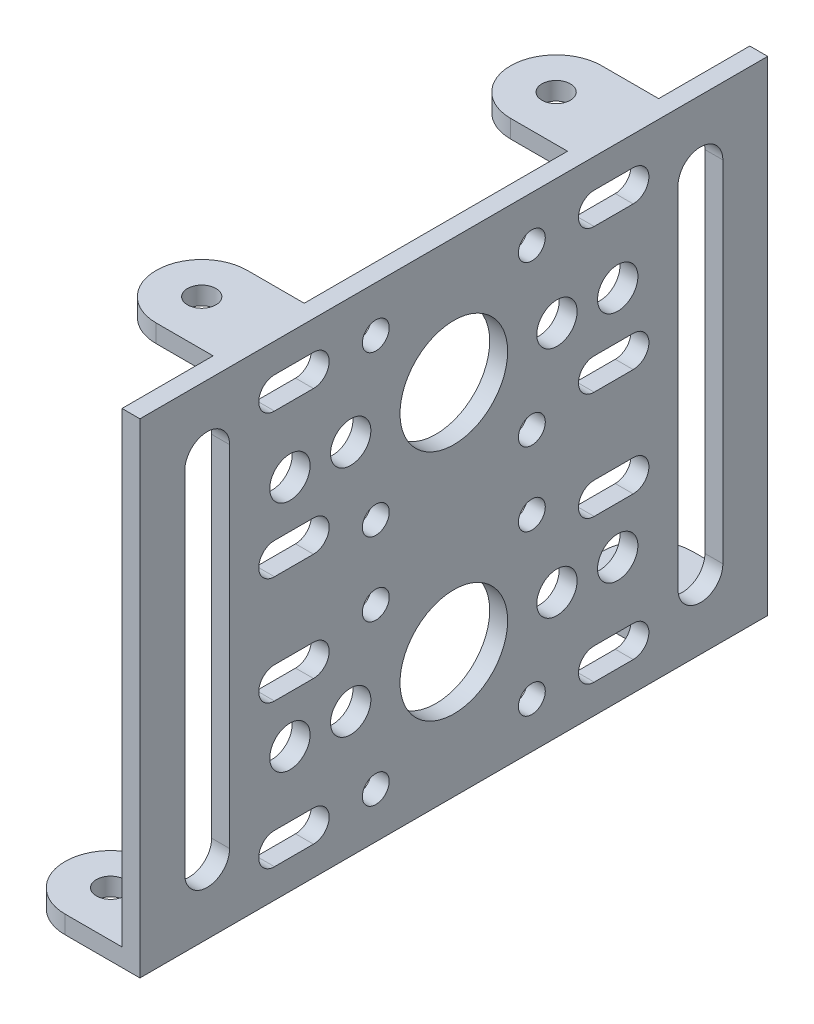
from build123d import *
from build123d.topology import SkipClean

# Parameters (mm, degrees)
SKETCH1_R            = 1.5
SKETCH1_R_2          = 2.25
BOSS_EXTRUDE1_DEPTH  = 2
BOSS_EXTRUDE3_DEPTH  = 2
SKETCH3_W            = 7.521273404
SKETCH3_H            = 51.057198878
CUT_EXTRUDE1_DEPTH   = 10
SKETCH4_R            = 1.5875
BOSS_EXTRUDE4_DEPTH  = 2
CUT_EXTRUDE2_START   = -2
SKETCH5_R            = 1.55
SKETCH5_R_2          = 1.5
CUT_EXTRUDE2_DEPTH   = 2
SKETCH7_R            = 1.5875
BOSS_EXTRUDE6_DEPTH  = 2
SKETCH8_W            = 8.556305001
SKETCH8_H            = 51.856152178
CUT_EXTRUDE3_DEPTH   = 2
SKETCH9_R            = 1.5875
BOSS_EXTRUDE31_DEPTH = 2
SKETCH10_R           = 1.5
SKETCH10_R_2         = 2.25
CUT_EXTRUDE4_DEPTH   = 10
BOSS_EXTRUDE32_START = -2
SKETCH11_R           = 2.25
BOSS_EXTRUDE32_DEPTH = 2
SKETCH12_R           = 2.25
CUT_EXTRUDE5_DEPTH   = 2
CUT_EXTRUDE6_START   = -2
SKETCH13_R           = 1.55
CUT_EXTRUDE6_DEPTH   = 2
BOSS_EXTRUDE33_START = -2
BOSS_EXTRUDE33_DEPTH = 2
CUT_EXTRUDE8_START   = -2
CUT_EXTRUDE8_DEPTH   = 2


with BuildPart() as part:
    # Sketch1 → Boss-Extrude1 (new body)
    # profile 1 of 5: a face of its own
    with BuildSketch(Plane(origin=(0, 0, 0), x_dir=(0, 0, -1), z_dir=(1, 0, 0))):
        with BuildLine():
            Line((63.077461316, 25.542000411), (88.077461316, 25.542000411))
            Line((88.077461316, 25.542000411), (88.077461316, 32.542000411))
            ThreePointArc((88.077461316, 32.542000411), (82.077461316, 38.542000411), (88.077461316, 44.542000411))
            Line((88.077461316, 44.542000411), (88.077461316, 52.542000411))
            Line((88.077461316, 52.542000411), (60.577461316, 52.542000411))
            Line((60.577461316, 52.542000411), (60.577461316, 47.542000411))
            ThreePointArc((60.577461316, 47.542000411), (62.345228269, 46.809767364), (63.077461316, 45.042000411))
            Line((63.077461316, 45.042000411), (63.077461316, 25.542000411))
        make_face()
        with Locations((72.077461316, 31.542000411)):
            Circle(SKETCH1_R, mode=Mode.SUBTRACT)
        with Locations((69.802461316, 37.748250471)):
            Circle(SKETCH1_R_2, mode=Mode.SUBTRACT)
    # profile 2 of 5: a face of its own
    with BuildSketch(Plane(origin=(0, 0, 0), x_dir=(0, 0, -1), z_dir=(1, 0, 0))):
        with BuildLine():
            Line((53.077461316, -1.457999589), (88.077461316, -1.457999589))
            Line((88.077461316, -1.457999589), (88.077461316, 6.542000411))
            ThreePointArc((88.077461316, 6.542000411), (82.077461316, 12.542000411), (88.077461316, 18.542000411))
            Line((88.077461316, 18.542000411), (88.077461316, 25.542000411))
            Line((88.077461316, 25.542000411), (63.077461316, 25.542000411))
            Line((63.077461316, 25.542000411), (63.077461316, 6.042000411))
            ThreePointArc((63.077461316, 6.042000411), (60.577461316, 3.542000411), (58.077461316, 6.042000411))
            Line((58.077461316, 6.042000411), (58.077461316, 25.542000411))
            Line((58.077461316, 25.542000411), (53.077461316, 25.542000411))
            Line((53.077461316, 25.542000411), (53.077461316, -1.457999589))
        make_face()
        with Locations((69.802461316, 13.335750351)):
            Circle(SKETCH1_R_2, mode=Mode.SUBTRACT)
        with Locations((72.077461316, 19.542000411)):
            Circle(SKETCH1_R, mode=Mode.SUBTRACT)
    # profile 3 of 5: a face of its own
    with BuildSketch(Plane(origin=(0, 0, 0), x_dir=(0, 0, -1), z_dir=(1, 0, 0))):
        with BuildLine():
            Line((53.077461316, 52.542000411), (53.077461316, 25.542000411))
            Line((53.077461316, 25.542000411), (58.077461316, 25.542000411))
            Line((58.077461316, 25.542000411), (58.077461316, 45.042000411))
            ThreePointArc((58.077461316, 45.042000411), (58.809694363, 46.809767364), (60.577461316, 47.542000411))
            Line((60.577461316, 47.542000411), (60.577461316, 52.542000411))
            Line((60.577461316, 52.542000411), (53.077461316, 52.542000411))
        make_face()
    # profile 4 of 5: a face of its own
    with BuildSketch(Plane(origin=(0, 0, 0), x_dir=(0, 0, -1), z_dir=(1, 0, 0))):
        with BuildLine():
            Line((88.077461316, 6.542000411), (88.077461316, -1.457999589))
            Line((88.077461316, -1.457999589), (123.077461316, -1.457999589))
            Line((123.077461316, -1.457999589), (123.077461316, 25.542000411))
            Line((123.077461316, 25.542000411), (118.077461316, 25.542000411))
            Line((118.077461316, 25.542000411), (118.077461316, 6.042000411))
            ThreePointArc((118.077461316, 6.042000411), (115.577461316, 3.542000411), (113.077461316, 6.042000411))
            Line((113.077461316, 6.042000411), (113.077461316, 25.542000411))
            Line((113.077461316, 25.542000411), (88.077461316, 25.542000411))
            Line((88.077461316, 25.542000411), (88.077461316, 18.542000411))
            ThreePointArc((88.077461316, 18.542000411), (92.320102003, 16.784641098), (94.077461316, 12.542000411))
            ThreePointArc((94.077461316, 12.542000411), (92.320102003, 8.299359724), (88.077461316, 6.542000411))
        make_face()
        with Locations((106.352461316, 13.335750351)):
            Circle(SKETCH1_R_2, mode=Mode.SUBTRACT)
        with Locations((104.077461316, 19.542000411)):
            Circle(SKETCH1_R, mode=Mode.SUBTRACT)
    # profile 5 of 5: a face of its own
    with BuildSketch(Plane(origin=(0, 0, 0), x_dir=(0, 0, -1), z_dir=(1, 0, 0))):
        with BuildLine():
            Line((118.077461316, 25.542000411), (123.077461316, 25.542000411))
            Line((123.077461316, 25.542000411), (123.077461316, 52.542000411))
            Line((123.077461316, 52.542000411), (88.077461316, 52.542000411))
            Line((88.077461316, 52.542000411), (88.077461316, 44.542000411))
            ThreePointArc((88.077461316, 44.542000411), (92.320102003, 42.784641098), (94.077461316, 38.542000411))
            ThreePointArc((94.077461316, 38.542000411), (92.320102003, 34.299359724), (88.077461316, 32.542000411))
            Line((88.077461316, 32.542000411), (88.077461316, 25.542000411))
            Line((88.077461316, 25.542000411), (113.077461316, 25.542000411))
            Line((113.077461316, 25.542000411), (113.077461316, 45.042000411))
            ThreePointArc((113.077461316, 45.042000411), (115.577461316, 47.542000411), (118.077461316, 45.042000411))
            Line((118.077461316, 45.042000411), (118.077461316, 25.542000411))
        make_face()
        with Locations((104.077461316, 31.542000411)):
            Circle(SKETCH1_R, mode=Mode.SUBTRACT)
        with Locations((106.352461316, 37.748250471)):
            Circle(SKETCH1_R_2, mode=Mode.SUBTRACT)
    extrude(amount=BOSS_EXTRUDE1_DEPTH)

    # Sketch2 → Boss-Extrude3 (add)
    with BuildSketch(Plane.XZ.offset(1.457999589)):
        with BuildLine():
            Line((-2.5, -123.077461316), (0, -123.077461316))
            Line((0, -123.077461316), (0, -120.577461316))
            Line((0, -120.577461316), (-0.9125, -120.577461316))
            ThreePointArc((-0.9125, -120.577461316), (-1.377467985, -121.699993331), (-2.5, -122.164961316))
            Line((-2.5, -122.164961316), (-2.5, -123.077461316))
        make_face()
        with BuildLine():
            ThreePointArc((-5, -120.577461316), (-4.267766953, -122.345228269), (-2.5, -123.077461316))
            Line((-2.5, -123.077461316), (-2.5, -122.164961316))
            ThreePointArc((-2.5, -122.164961316), (-3.622532015, -121.699993331), (-4.0875, -120.577461316))
            Line((-4.0875, -120.577461316), (-5, -120.577461316))
        make_face()
        with BuildLine():
            ThreePointArc((-2.5, -118.077461316), (-4.267766953, -118.809694363), (-5, -120.577461316))
            Line((-5, -120.577461316), (-4.0875, -120.577461316))
            ThreePointArc((-4.0875, -120.577461316), (-3.622532015, -119.454929301), (-2.5, -118.989961316))
            Line((-2.5, -118.989961316), (-2.5, -118.077461316))
        make_face()
        with BuildLine():
            Line((-0.9125, -120.577461316), (0, -120.577461316))
            Line((0, -120.577461316), (0, -118.077461316))
            Line((0, -118.077461316), (-2.5, -118.077461316))
            Line((-2.5, -118.077461316), (-2.5, -118.989961316))
            ThreePointArc((-2.5, -118.989961316), (-1.377467985, -119.454929301), (-0.9125, -120.577461316))
        make_face()
        with BuildLine():
            Line((0, -113.077461316), (0, -110.577461316))
            Line((0, -110.577461316), (-0.9125, -110.577461316))
            ThreePointArc((-0.9125, -110.577461316), (-1.377467985, -111.699993331), (-2.5, -112.164961316))
            Line((-2.5, -112.164961316), (-2.5, -113.077461316))
            Line((-2.5, -113.077461316), (0, -113.077461316))
        make_face()
        with BuildLine():
            Line((-2.5, -108.989961316), (-2.5, -108.077461316))
            ThreePointArc((-2.5, -108.077461316), (-4.267766953, -108.809694363), (-5, -110.577461316))
            Line((-5, -110.577461316), (-4.0875, -110.577461316))
            ThreePointArc((-4.0875, -110.577461316), (-3.622532015, -109.454929301), (-2.5, -108.989961316))
        make_face()
        with BuildLine():
            Line((-4.0875, -110.577461316), (-5, -110.577461316))
            ThreePointArc((-5, -110.577461316), (-4.267766953, -112.345228269), (-2.5, -113.077461316))
            Line((-2.5, -113.077461316), (-2.5, -112.164961316))
            ThreePointArc((-2.5, -112.164961316), (-3.622532015, -111.699993331), (-4.0875, -110.577461316))
        make_face()
        with BuildLine():
            Line((0, -110.577461316), (0, -108.077461316))
            Line((0, -108.077461316), (-2.5, -108.077461316))
            Line((-2.5, -108.077461316), (-2.5, -108.989961316))
            ThreePointArc((-2.5, -108.989961316), (-1.377467985, -109.454929301), (-0.9125, -110.577461316))
            Line((-0.9125, -110.577461316), (0, -110.577461316))
        make_face()
        with BuildLine():
            Line((-2.5, -68.077461316), (0, -68.077461316))
            Line((0, -68.077461316), (0, -65.577461316))
            Line((0, -65.577461316), (-0.9125, -65.577461316))
            ThreePointArc((-0.9125, -65.577461316), (-1.377467985, -66.699993331), (-2.5, -67.164961316))
            Line((-2.5, -67.164961316), (-2.5, -68.077461316))
        make_face()
        with BuildLine():
            Line((-0.9125, -65.577461316), (0, -65.577461316))
            Line((0, -65.577461316), (0, -63.077461316))
            Line((0, -63.077461316), (-2.5, -63.077461316))
            Line((-2.5, -63.077461316), (-2.5, -63.989961316))
            ThreePointArc((-2.5, -63.989961316), (-1.377467985, -64.454929301), (-0.9125, -65.577461316))
        make_face()
        with BuildLine():
            ThreePointArc((-5, -65.577461316), (-4.267766953, -67.345228269), (-2.5, -68.077461316))
            Line((-2.5, -68.077461316), (-2.5, -67.164961316))
            ThreePointArc((-2.5, -67.164961316), (-3.622532015, -66.699993331), (-4.0875, -65.577461316))
            Line((-4.0875, -65.577461316), (-5, -65.577461316))
        make_face()
        with BuildLine():
            ThreePointArc((-2.5, -63.077461316), (-4.267766953, -63.809694363), (-5, -65.577461316))
            Line((-5, -65.577461316), (-4.0875, -65.577461316))
            ThreePointArc((-4.0875, -65.577461316), (-3.622532015, -64.454929301), (-2.5, -63.989961316))
            Line((-2.5, -63.989961316), (-2.5, -63.077461316))
        make_face()
        with BuildLine():
            Line((-2.5, -53.989961316), (-2.5, -53.077461316))
            ThreePointArc((-2.5, -53.077461316), (-4.267766953, -53.809694363), (-5, -55.577461316))
            Line((-5, -55.577461316), (-4.0875, -55.577461316))
            ThreePointArc((-4.0875, -55.577461316), (-3.622532015, -54.454929301), (-2.5, -53.989961316))
        make_face()
        with BuildLine():
            Line((-4.0875, -55.577461316), (-5, -55.577461316))
            ThreePointArc((-5, -55.577461316), (-4.267766953, -57.345228269), (-2.5, -58.077461316))
            Line((-2.5, -58.077461316), (-2.5, -57.164961316))
            ThreePointArc((-2.5, -57.164961316), (-3.622532015, -56.699993331), (-4.0875, -55.577461316))
        make_face()
        with BuildLine():
            Line((0, -58.077461316), (0, -55.577461316))
            Line((0, -55.577461316), (-0.9125, -55.577461316))
            ThreePointArc((-0.9125, -55.577461316), (-1.377467985, -56.699993331), (-2.5, -57.164961316))
            Line((-2.5, -57.164961316), (-2.5, -58.077461316))
            Line((-2.5, -58.077461316), (0, -58.077461316))
        make_face()
        with BuildLine():
            Line((0, -55.577461316), (0, -53.077461316))
            Line((0, -53.077461316), (-2.5, -53.077461316))
            Line((-2.5, -53.077461316), (-2.5, -53.989961316))
            ThreePointArc((-2.5, -53.989961316), (-1.377467985, -54.454929301), (-0.9125, -55.577461316))
            Line((-0.9125, -55.577461316), (0, -55.577461316))
        make_face()
    extrude(amount=-BOSS_EXTRUDE3_DEPTH)

    # Sketch3 → Cut-Extrude1 (cut)
    with BuildSketch(Plane(origin=(0, 0.542000411, 0), x_dir=(1, 0, 0), z_dir=(0, 1, 0))):
        with Locations((-3.760636702, 87.548861877)):
            Rectangle(SKETCH3_W, SKETCH3_H)
    extrude(amount=-CUT_EXTRUDE1_DEPTH, mode=Mode.SUBTRACT)

    # Sketch4 → Boss-Extrude4 (add)
    # profile 1 of 2: a face of its own
    with BuildSketch(Plane(origin=(0, 52.542000411, 0), x_dir=(1, 0, 0), z_dir=(0, 1, 0))):
        with BuildLine():
            Line((-2.5, 108.077461316), (0, 108.077461316))
            Line((0, 108.077461316), (0, 113.077461316))
            Line((0, 113.077461316), (-2.5, 113.077461316))
            ThreePointArc((-2.5, 113.077461316), (-5, 110.577461316), (-2.5, 108.077461316))
        make_face()
        with Locations(Location((-2.5, 110.577461316, 0), (0, 0, 270))):
            Circle(SKETCH4_R, mode=Mode.SUBTRACT)
    # profile 2 of 2: a face of its own
    with BuildSketch(Plane(origin=(0, 52.542000411, 0), x_dir=(1, 0, 0), z_dir=(0, 1, 0))):
        with BuildLine():
            Line((0, 63.077461316), (0, 68.077461316))
            Line((0, 68.077461316), (-2.5, 68.077461316))
            ThreePointArc((-2.5, 68.077461316), (-5, 65.577461316), (-2.5, 63.077461316))
            Line((-2.5, 63.077461316), (0, 63.077461316))
        make_face()
        with Locations(Location((-2.5, 65.577461316, 0), (0, 0, 270))):
            Circle(SKETCH4_R, mode=Mode.SUBTRACT)
    extrude(amount=-BOSS_EXTRUDE4_DEPTH)

    # Sketch5 → Cut-Extrude2 (cut)
    # profile 1 of 12: a face of its own
    with BuildSketch(Plane(origin=(2, 0, 0), x_dir=(0, 0, -1), z_dir=(1, 0, 0)).offset(CUT_EXTRUDE2_START)):
        with Locations((108.427461316, 19.542000411)):
            Circle(SKETCH5_R)
    # profile 2 of 12: a face of its own
    with BuildSketch(Plane(origin=(2, 0, 0), x_dir=(0, 0, -1), z_dir=(1, 0, 0)).offset(CUT_EXTRUDE2_START)):
        with Locations((67.727461316, 19.542000411)):
            Circle(SKETCH5_R)
    # profile 3 of 12: a face of its own
    with BuildSketch(Plane(origin=(2, 0, 0), x_dir=(0, 0, -1), z_dir=(1, 0, 0)).offset(CUT_EXTRUDE2_START)):
        with Locations((72.077461316, 19.542000411)):
            Circle(SKETCH5_R)
        with Locations((72.077461316, 19.542000411)):
            Circle(SKETCH5_R_2, mode=Mode.SUBTRACT)
    # profile 4 of 12: a face of its own
    with BuildSketch(Plane(origin=(2, 0, 0), x_dir=(0, 0, -1), z_dir=(1, 0, 0)).offset(CUT_EXTRUDE2_START)):
        with Locations((67.727461316, 31.542000411)):
            Circle(SKETCH5_R)
    # profile 5 of 12: a face of its own
    with BuildSketch(Plane(origin=(2, 0, 0), x_dir=(0, 0, -1), z_dir=(1, 0, 0)).offset(CUT_EXTRUDE2_START)):
        with Locations((72.077461316, 31.542000411)):
            Circle(SKETCH5_R)
        with Locations((72.077461316, 31.542000411)):
            Circle(SKETCH5_R_2, mode=Mode.SUBTRACT)
    # profile 6 of 12: a face of its own
    with BuildSketch(Plane(origin=(2, 0, 0), x_dir=(0, 0, -1), z_dir=(1, 0, 0)).offset(CUT_EXTRUDE2_START)):
        with Locations((108.427461316, 31.542000411)):
            Circle(SKETCH5_R)
    # profile 7 of 12: a face of its own
    with BuildSketch(Plane(origin=(2, 0, 0), x_dir=(0, 0, -1), z_dir=(1, 0, 0)).offset(CUT_EXTRUDE2_START)):
        with Locations((67.727461316, 5.822000411)):
            Circle(SKETCH5_R)
    # profile 8 of 12: a face of its own
    with BuildSketch(Plane(origin=(2, 0, 0), x_dir=(0, 0, -1), z_dir=(1, 0, 0)).offset(CUT_EXTRUDE2_START)):
        with Locations((108.427461316, 5.822000411)):
            Circle(SKETCH5_R)
    # profile 9 of 12: a face of its own
    with BuildSketch(Plane(origin=(2, 0, 0), x_dir=(0, 0, -1), z_dir=(1, 0, 0)).offset(CUT_EXTRUDE2_START)):
        with Locations((104.077461316, 19.542000411)):
            Circle(SKETCH5_R)
        with Locations((104.077461316, 19.542000411)):
            Circle(SKETCH5_R_2, mode=Mode.SUBTRACT)
    # profile 10 of 12: a face of its own
    with BuildSketch(Plane(origin=(2, 0, 0), x_dir=(0, 0, -1), z_dir=(1, 0, 0)).offset(CUT_EXTRUDE2_START)):
        with Locations((104.077461316, 31.542000411)):
            Circle(SKETCH5_R)
        with Locations((104.077461316, 31.542000411)):
            Circle(SKETCH5_R_2, mode=Mode.SUBTRACT)
    # profile 11 of 12: a face of its own
    with BuildSketch(Plane(origin=(2, 0, 0), x_dir=(0, 0, -1), z_dir=(1, 0, 0)).offset(CUT_EXTRUDE2_START)):
        with Locations((108.427461316, 45.262000411)):
            Circle(SKETCH5_R)
    # profile 12 of 12: a face of its own
    with BuildSketch(Plane(origin=(2, 0, 0), x_dir=(0, 0, -1), z_dir=(1, 0, 0)).offset(CUT_EXTRUDE2_START)):
        with Locations((67.727461316, 45.262000411)):
            Circle(SKETCH5_R)
    extrude(amount=CUT_EXTRUDE2_DEPTH, mode=Mode.SUBTRACT)

    # Sketch7 → Boss-Extrude6 (add)
    # profile 1 of 2: a face of its own
    with BuildSketch(Plane(origin=(0, 0.542000411, 0), x_dir=(1, 0, 0), z_dir=(0, 1, 0))):
        with BuildLine():
            Line((0, 53.077461316), (0, 63.237461316))
            Line((0, 63.237461316), (-6.35, 63.237461316))
            ThreePointArc((-6.35, 63.237461316), (-11.43, 58.157461316), (-6.35, 53.077461316))
            Line((-6.35, 53.077461316), (0, 53.077461316))
        make_face()
        with Locations(Location((-6.35, 58.157461316, 0), (0, 0, 270))):
            Circle(SKETCH7_R, mode=Mode.SUBTRACT)
    # profile 2 of 2: a face of its own
    with BuildSketch(Plane(origin=(0, 0.542000411, 0), x_dir=(1, 0, 0), z_dir=(0, 1, 0))):
        with BuildLine():
            Line((0, 123.077461316), (-6.35, 123.077461316))
            ThreePointArc((-6.35, 123.077461316), (-11.43, 117.997461316), (-6.35, 112.917461316))
            Line((-6.35, 112.917461316), (0, 112.917461316))
            Line((0, 112.917461316), (0, 123.077461316))
        make_face()
        with Locations(Location((-6.35, 117.997461316, 0), (0, 0, 270))):
            Circle(SKETCH7_R, mode=Mode.SUBTRACT)
    extrude(amount=-BOSS_EXTRUDE6_DEPTH)

    # Sketch8 → Cut-Extrude3 (cut)
    with BuildSketch(Plane(origin=(0, 52.542000411, 0), x_dir=(1, 0, 0), z_dir=(0, 1, 0))):
        with Locations((-4.278152501, 87.149385227)):
            Rectangle(SKETCH8_W, SKETCH8_H)
    extrude(amount=-CUT_EXTRUDE3_DEPTH, mode=Mode.SUBTRACT)

    # Sketch9 → Boss-Extrude31 (add)
    # profile 1 of 2: a face of its own
    with BuildSketch(Plane(origin=(0, 52.542000411, 0), x_dir=(1, 0, 0), z_dir=(0, 1, 0))):
        with BuildLine():
            Line((0, 112.917461316), (0, 102.757461316))
            Line((0, 102.757461316), (-6.35, 102.757461316))
            ThreePointArc((-6.35, 102.757461316), (-11.43, 107.837461316), (-6.35, 112.917461316))
            Line((-6.35, 112.917461316), (0, 112.917461316))
        make_face()
        with Locations(Location((-6.35, 107.837461316, 0), (0, 0, 270))):
            Circle(SKETCH9_R, mode=Mode.SUBTRACT)
    # profile 2 of 2: a face of its own
    with BuildSketch(Plane(origin=(0, 52.542000411, 0), x_dir=(1, 0, 0), z_dir=(0, 1, 0))):
        with BuildLine():
            Line((0, 73.397461316), (-6.35, 73.397461316))
            ThreePointArc((-6.35, 73.397461316), (-11.43, 68.317461316), (-6.35, 63.237461316))
            Line((-6.35, 63.237461316), (0, 63.237461316))
            Line((0, 63.237461316), (0, 73.397461316))
        make_face()
        with Locations(Location((-6.35, 68.317461316, 0), (0, 0, 270))):
            Circle(SKETCH9_R, mode=Mode.SUBTRACT)
    extrude(amount=-BOSS_EXTRUDE31_DEPTH)

    # Sketch10 → Cut-Extrude4 (cut)
    with BuildSketch(Plane(origin=(2, 0, 0), x_dir=(0, 0, -1), z_dir=(1, 0, 0))):
        with Locations((79.377461316, 47.442000411)):
            Circle(SKETCH10_R)
        with Locations((76.577461316, 38.542000411)):
            Circle(SKETCH10_R_2)
        with Locations((96.777461316, 47.442000411)):
            Circle(SKETCH10_R)
        with Locations((99.577461316, 38.542000411)):
            Circle(SKETCH10_R_2)
        with Locations((96.777461316, 29.642000411)):
            Circle(SKETCH10_R)
        with Locations((79.377461316, 29.642000411)):
            Circle(SKETCH10_R)
        with Locations((79.377461316, 21.442000411)):
            Circle(SKETCH10_R)
        with Locations((96.777461316, 21.442000411)):
            Circle(SKETCH10_R)
        with Locations((99.577461316, 12.542000411)):
            Circle(SKETCH10_R_2)
        with Locations((76.577461316, 12.542000411)):
            Circle(SKETCH10_R_2)
        with Locations((79.377461316, 3.642000411)):
            Circle(SKETCH10_R)
        with Locations((96.777461316, 3.642000411)):
            Circle(SKETCH10_R)
    extrude(amount=-CUT_EXTRUDE4_DEPTH, mode=Mode.SUBTRACT)

    # Sketch11 → Boss-Extrude32 (add)
    with BuildSketch(Plane(origin=(2, 0, 0), x_dir=(0, 0, -1), z_dir=(1, 0, 0)).offset(BOSS_EXTRUDE32_START)):
        with Locations((69.802461316, 37.748250471)):
            Circle(SKETCH11_R)
        with Locations((69.802461316, 13.335750351)):
            Circle(SKETCH11_R)
        with Locations((106.352461316, 37.748250471)):
            Circle(SKETCH11_R)
        with Locations((106.352461316, 13.335750351)):
            Circle(SKETCH11_R)
    extrude(amount=BOSS_EXTRUDE32_DEPTH)

    # Sketch12 → Cut-Extrude5 (cut)
    with BuildSketch(Plane(origin=(2, 0, 0), x_dir=(0, 0, -1), z_dir=(1, 0, 0))):
        with Locations((69.802461316, 12.542000411)):
            Circle(SKETCH12_R)
        with Locations((69.802461316, 38.542000411)):
            Circle(SKETCH12_R)
        with Locations((106.352461316, 12.542000411)):
            Circle(SKETCH12_R)
        with Locations((106.352461316, 38.542000411)):
            Circle(SKETCH12_R)
    extrude(amount=-CUT_EXTRUDE5_DEPTH, mode=Mode.SUBTRACT)

    # Sketch13 → Cut-Extrude6 (cut)
    # profile 1 of 12: a face of its own
    with BuildSketch(Plane(origin=(2, 0, 0), x_dir=(0, 0, -1), z_dir=(1, 0, 0)).offset(CUT_EXTRUDE6_START)):
        with Locations((67.727461316, 45.262000411)):
            Circle(SKETCH13_R)
    # profile 2 of 12: a face of its own
    with BuildSketch(Plane(origin=(2, 0, 0), x_dir=(0, 0, -1), z_dir=(1, 0, 0)).offset(CUT_EXTRUDE6_START)):
        with BuildLine():
            ThreePointArc((72.427461316, 49.292000411), (74.177461316, 47.542000411), (72.427461316, 45.792000411))
            Line((72.427461316, 45.792000411), (68.077461316, 45.792000411))
            ThreePointArc((68.077461316, 45.792000411), (66.327461316, 47.542000411), (68.077461316, 49.292000411))
            Line((68.077461316, 49.292000411), (72.427461316, 49.292000411))
        make_face()
    # profile 3 of 12: a face of its own
    with BuildSketch(Plane(origin=(2, 0, 0), x_dir=(0, 0, -1), z_dir=(1, 0, 0)).offset(CUT_EXTRUDE6_START)):
        with Locations((108.427461316, 45.262000411)):
            Circle(SKETCH13_R)
    # profile 4 of 12: a face of its own
    with BuildSketch(Plane(origin=(2, 0, 0), x_dir=(0, 0, -1), z_dir=(1, 0, 0)).offset(CUT_EXTRUDE6_START)):
        with BuildLine():
            ThreePointArc((108.077461316, 49.292000411), (109.827461316, 47.542000411), (108.077461316, 45.792000411))
            Line((108.077461316, 45.792000411), (103.727461316, 45.792000411))
            ThreePointArc((103.727461316, 45.792000411), (101.977461316, 47.542000411), (103.727461316, 49.292000411))
            Line((103.727461316, 49.292000411), (108.077461316, 49.292000411))
        make_face()
    # profile 5 of 12: a face of its own
    with BuildSketch(Plane(origin=(2, 0, 0), x_dir=(0, 0, -1), z_dir=(1, 0, 0)).offset(CUT_EXTRUDE6_START)):
        with Locations((108.427461316, 19.542000411)):
            Circle(SKETCH13_R)
    # profile 6 of 12: a face of its own
    with BuildSketch(Plane(origin=(2, 0, 0), x_dir=(0, 0, -1), z_dir=(1, 0, 0)).offset(CUT_EXTRUDE6_START)):
        with BuildLine():
            ThreePointArc((108.077461316, 21.292000411), (109.827461316, 19.542000411), (108.077461316, 17.792000411))
            Line((108.077461316, 17.792000411), (103.727461316, 17.792000411))
            ThreePointArc((103.727461316, 17.792000411), (101.977461316, 19.542000411), (103.727461316, 21.292000411))
            Line((103.727461316, 21.292000411), (108.077461316, 21.292000411))
        make_face()
        with Locations((104.077461316, 19.542000411)):
            Circle(SKETCH13_R, mode=Mode.SUBTRACT)
    # profile 7 of 12: a face of its own
    with BuildSketch(Plane(origin=(2, 0, 0), x_dir=(0, 0, -1), z_dir=(1, 0, 0)).offset(CUT_EXTRUDE6_START)):
        with Locations((67.727461316, 19.542000411)):
            Circle(SKETCH13_R)
    # profile 8 of 12: a face of its own
    with BuildSketch(Plane(origin=(2, 0, 0), x_dir=(0, 0, -1), z_dir=(1, 0, 0)).offset(CUT_EXTRUDE6_START)):
        with BuildLine():
            ThreePointArc((72.427461316, 21.292000411), (74.177461316, 19.542000411), (72.427461316, 17.792000411))
            Line((72.427461316, 17.792000411), (68.077461316, 17.792000411))
            ThreePointArc((68.077461316, 17.792000411), (66.327461316, 19.542000411), (68.077461316, 21.292000411))
            Line((68.077461316, 21.292000411), (72.427461316, 21.292000411))
        make_face()
        with Locations((72.077461316, 19.542000411)):
            Circle(SKETCH13_R, mode=Mode.SUBTRACT)
    # profile 9 of 12: a face of its own
    with BuildSketch(Plane(origin=(2, 0, 0), x_dir=(0, 0, -1), z_dir=(1, 0, 0)).offset(CUT_EXTRUDE6_START)):
        with Locations((67.727461316, 5.822000411)):
            Circle(SKETCH13_R)
    # profile 10 of 12: a face of its own
    with BuildSketch(Plane(origin=(2, 0, 0), x_dir=(0, 0, -1), z_dir=(1, 0, 0)).offset(CUT_EXTRUDE6_START)):
        with BuildLine():
            ThreePointArc((68.077461316, 1.792000411), (66.327461316, 3.542000411), (68.077461316, 5.292000411))
            Line((68.077461316, 5.292000411), (72.427461316, 5.292000411))
            ThreePointArc((72.427461316, 5.292000411), (74.177461316, 3.542000411), (72.427461316, 1.792000411))
            Line((72.427461316, 1.792000411), (68.077461316, 1.792000411))
        make_face()
    # profile 11 of 12: a face of its own
    with BuildSketch(Plane(origin=(2, 0, 0), x_dir=(0, 0, -1), z_dir=(1, 0, 0)).offset(CUT_EXTRUDE6_START)):
        with Locations((108.427461316, 5.822000411)):
            Circle(SKETCH13_R)
    # profile 12 of 12: a face of its own
    with BuildSketch(Plane(origin=(2, 0, 0), x_dir=(0, 0, -1), z_dir=(1, 0, 0)).offset(CUT_EXTRUDE6_START)):
        with BuildLine():
            ThreePointArc((103.727461316, 1.792000411), (101.977461316, 3.542000411), (103.727461316, 5.292000411))
            Line((103.727461316, 5.292000411), (108.077461316, 5.292000411))
            ThreePointArc((108.077461316, 5.292000411), (109.827461316, 3.542000411), (108.077461316, 1.792000411))
            Line((108.077461316, 1.792000411), (103.727461316, 1.792000411))
        make_face()
    extrude(amount=CUT_EXTRUDE6_DEPTH, mode=Mode.SUBTRACT)

    # Sketch14 → Boss-Extrude33 (add)
    with SkipClean():  # the faces are left unmerged after this step: merging them gives an invalid solid
        with BuildSketch(Plane(origin=(2, 0, 0), x_dir=(0, 0, -1), z_dir=(1, 0, 0)).offset(BOSS_EXTRUDE33_START)):
            with BuildLine():
                ThreePointArc((68.077461316, 5.292000411), (67.325074023, 5.122004639), (66.718861196, 4.645044252))
                ThreePointArc((66.718861196, 4.645044252), (67.334005326, 7.321231008), (69.184032632, 5.292000411))
                Line((69.184032632, 5.292000411), (68.077461316, 5.292000411))
            make_face()
            with BuildLine():
                ThreePointArc((106.970889999, 5.292000411), (108.820917306, 7.321231008), (109.436061435, 4.645044252))
                ThreePointArc((109.436061435, 4.645044252), (108.829848609, 5.122004639), (108.077461316, 5.292000411))
                Line((108.077461316, 5.292000411), (106.970889999, 5.292000411))
            make_face()
            with BuildLine():
                ThreePointArc((66.959604173, 20.888438456), (66.327461316, 19.542000411), (66.959604173, 18.195562366))
                ThreePointArc((66.959604173, 18.195562366), (66.177461316, 19.542000411), (66.959604173, 20.888438456))
            make_face()
            with BuildLine():
                ThreePointArc((109.195318459, 20.888438456), (109.977461316, 19.542000411), (109.195318459, 18.195562366))
                ThreePointArc((109.195318459, 18.195562366), (109.827461316, 19.542000411), (109.195318459, 20.888438456))
            make_face()
            with BuildLine():
                ThreePointArc((66.959604173, 30.195562366), (66.177461316, 31.542000411), (66.959604173, 32.888438456))
                ThreePointArc((66.959604173, 32.888438456), (66.327461316, 31.542000411), (66.959604173, 30.195562366))
            make_face()
            with BuildLine():
                ThreePointArc((109.195318459, 30.195562366), (109.827461316, 31.542000411), (109.195318459, 32.888438456))
                ThreePointArc((109.195318459, 32.888438456), (109.977461316, 31.542000411), (109.195318459, 30.195562366))
            make_face()
            with BuildLine():
                ThreePointArc((69.184032632, 45.792000411), (67.334005326, 43.762769814), (66.718861196, 46.43895657))
                ThreePointArc((66.718861196, 46.43895657), (67.325074023, 45.961996183), (68.077461316, 45.792000411))
                Line((68.077461316, 45.792000411), (69.184032632, 45.792000411))
            make_face()
            with BuildLine():
                ThreePointArc((108.077461316, 45.792000411), (108.829848609, 45.961996183), (109.436061435, 46.43895657))
                ThreePointArc((109.436061435, 46.43895657), (108.820917306, 43.762769814), (106.970889999, 45.792000411))
                Line((106.970889999, 45.792000411), (108.077461316, 45.792000411))
            make_face()
        extrude(amount=BOSS_EXTRUDE33_DEPTH)

    # Sketch15 → Cut-Extrude8 (cut)
    with SkipClean():  # the faces are left unmerged after this step: merging them gives an invalid solid
        with BuildSketch(Plane(origin=(2, 0, 0), x_dir=(0, 0, -1), z_dir=(1, 0, 0)).offset(CUT_EXTRUDE8_START)):
            with BuildLine():
                Line((103.727461316, 29.792000411), (108.077461316, 29.792000411))
                ThreePointArc((108.077461316, 29.792000411), (109.827461316, 31.542000411), (108.077461316, 33.292000411))
                Line((108.077461316, 33.292000411), (103.727461316, 33.292000411))
                ThreePointArc((103.727461316, 33.292000411), (101.977461316, 31.542000411), (103.727461316, 29.792000411))
            make_face()
            with BuildLine():
                Line((72.427461316, 33.292000411), (68.077461316, 33.292000411))
                ThreePointArc((68.077461316, 33.292000411), (66.327461316, 31.542000411), (68.077461316, 29.792000411))
                Line((68.077461316, 29.792000411), (72.427461316, 29.792000411))
                ThreePointArc((72.427461316, 29.792000411), (74.177461316, 31.542000411), (72.427461316, 33.292000411))
            make_face()
        extrude(amount=CUT_EXTRUDE8_DEPTH, mode=Mode.SUBTRACT)


solid = part.part
